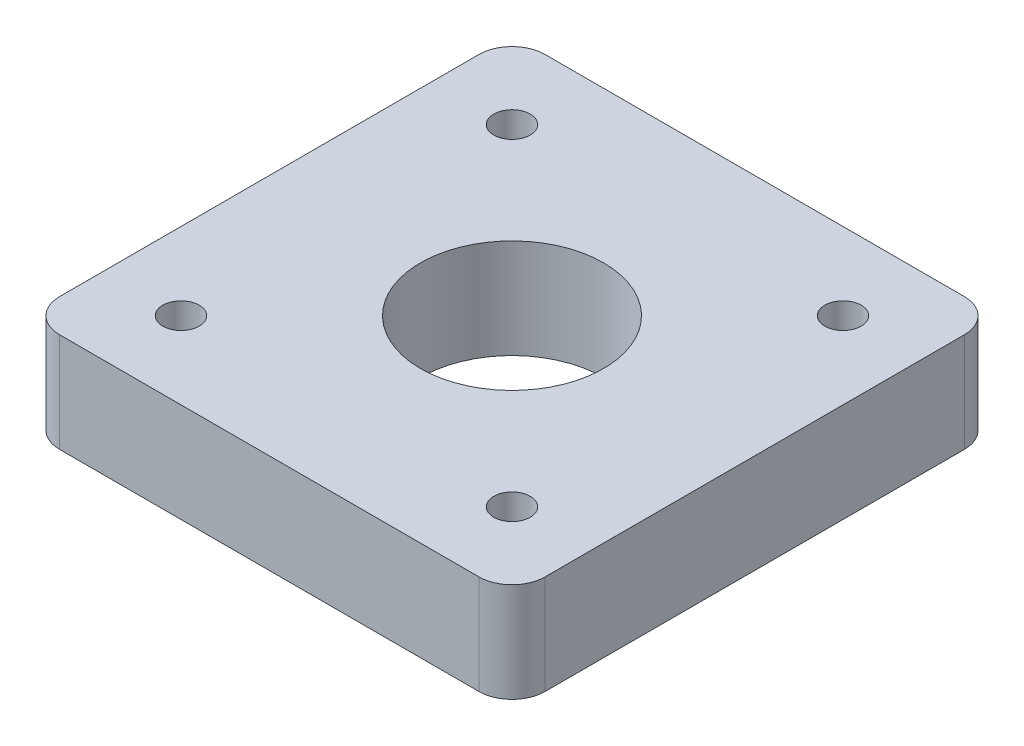
from build123d import *

# Parameters (mm, degrees)
SKETCH_1_W          = 44
SKETCH_1_H          = 9
RAISED_FLANGE_DEPTH = 44
FILLET_2_R          = 3
SKETCH_2_R          = 8.3
FLANGE_HOLE_DEPTH   = 63.872887638
SKETCH_3_R          = 1.65
CUT_EXTRUDE_2_DEPTH = 63.872887638
SKETCH_4_R          = 1.65
CUT_EXTRUDE_3_DEPTH = 63.872887638
SKETCH_5_R          = 1.65
CUT_EXTRUDE_4_DEPTH = 63.872887638
SKETCH_6_R          = 1.65
CUT_EXTRUDE_5_DEPTH = 63.872887638


with BuildPart() as part:
    # 草图1 → Raised_flange (new body)
    with BuildSketch(Plane.XY):
        with Locations((22, 4.5)):
            Rectangle(SKETCH_1_W, SKETCH_1_H)
    extrude(amount=RAISED_FLANGE_DEPTH)

    # Fillet 2
    fillet_2_edges = [part.edges().sort_by_distance(p)[0] for p in [
        (44, 4.5, 44),
        (0, 4.5, 44),
        (44, 4.5, 0),
        (0, 4.5, 0),
    ]]
    fillet(fillet_2_edges, radius=FILLET_2_R)

    # 草图2 → Flange_hole (cut, through all)
    with BuildSketch(Plane(origin=(0, 9, 0), x_dir=(1, 0, 0), z_dir=(0, 1, 0))):
        with Locations(Location((22, -22, 0), (0, 0, 270))):
            Circle(SKETCH_2_R)
    extrude(amount=-FLANGE_HOLE_DEPTH, mode=Mode.SUBTRACT)

    # 草图3 → 切除-拉伸2 (cut, through all)
    with BuildSketch(Plane(origin=(0, 9, 0), x_dir=(1, 0, 0), z_dir=(0, 1, 0))):
        with Locations(Location((7, -7, 0), (0, 0, 270))):
            Circle(SKETCH_3_R)
    extrude(amount=-CUT_EXTRUDE_2_DEPTH, mode=Mode.SUBTRACT)

    # 草图4 → 切除-拉伸3 (cut, through all)
    with BuildSketch(Plane(origin=(0, 9, 0), x_dir=(1, 0, 0), z_dir=(0, 1, 0))):
        with Locations(Location((7, -37, 0), (0, 0, 270))):
            Circle(SKETCH_4_R)
    extrude(amount=-CUT_EXTRUDE_3_DEPTH, mode=Mode.SUBTRACT)

    # 草图5 → 切除-拉伸4 (cut, through all)
    with BuildSketch(Plane(origin=(0, 9, 0), x_dir=(1, 0, 0), z_dir=(0, 1, 0))):
        with Locations(Location((37, -7, 0), (0, 0, 270))):
            Circle(SKETCH_5_R)
    extrude(amount=-CUT_EXTRUDE_4_DEPTH, mode=Mode.SUBTRACT)

    # 草图6 → 切除-拉伸5 (cut, through all)
    with BuildSketch(Plane(origin=(0, 9, 0), x_dir=(1, 0, 0), z_dir=(0, 1, 0))):
        with Locations(Location((37, -37, 0), (0, 0, 270))):
            Circle(SKETCH_6_R)
    extrude(amount=-CUT_EXTRUDE_5_DEPTH, mode=Mode.SUBTRACT)


solid = part.part
